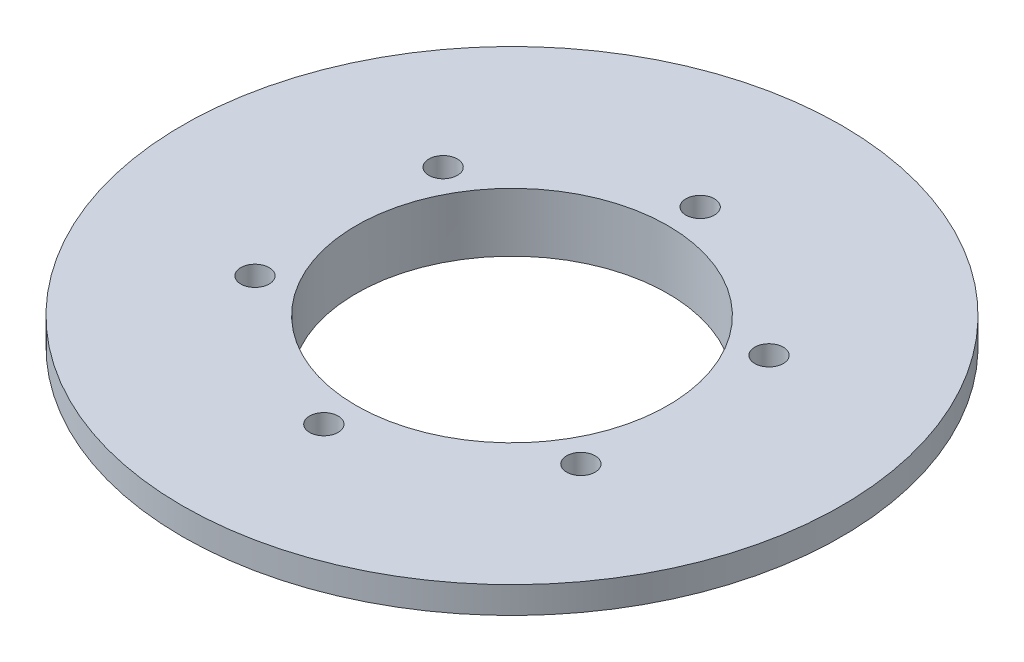
from build123d import *

# Parameters (mm, degrees)
SKETCH3_R               = 24.75
BOSS_EXTRUDE1_DEPTH     = 3.6
CUT_EXTRUDE1_DEPTH      = 53.740496774
CUT_EXTRUDE1_DEPTH_BACK = 53.740496774
SKETCH4_R               = 17.5
CUT_EXTRUDE2_DEPTH      = 53.740496774
CUT_EXTRUDE2_DEPTH_BACK = 53.740496774
SKETCH5_R               = 1.6


with BuildPart() as part:
    # Sketch2 → Revolve1 (revolve)
    with BuildSketch(Plane.XY, mode=Mode.PRIVATE) as revolve1_sk:
        with BuildLine():
            Line((-34.322848467, 0), (-37, 0))
            Line((-37, 0), (-37, 3))
            Line((-37, 3), (0, 3))
            Line((0, 3), (0, 0))
            Line((0, 0), (-29.677151533, 0))
            ThreePointArc((-29.677151533, 0), (-32, 2.225), (-34.322848467, 0))
        make_face()
    revolve(revolve1_sk.sketch.rotate(Axis((0, 0, 0), (0, 1, 0)), 270), axis=Axis((0, 0, 0), (0, 1, 0)))

    # Sketch3 → Boss-Extrude1 (add)
    with BuildSketch(Plane.XZ):
        with Locations(Location((0, 0, 0), (0, 0, 90))):
            Circle(SKETCH3_R)
    extrude(amount=BOSS_EXTRUDE1_DEPTH)

    # Sketch4 → Cut-Extrude1 (cut, two sides: drawn at the far end of the back side and taken through both)
    with BuildSketch(Plane(origin=(0, 3, 0), x_dir=(1, 0, 0), z_dir=(0, 1, 0)).offset(-CUT_EXTRUDE1_DEPTH_BACK)):
        with Locations(Location((0, 0, 0), (0, 0, 270))):
            Circle(SKETCH4_R)
    extrude(amount=CUT_EXTRUDE1_DEPTH + CUT_EXTRUDE1_DEPTH_BACK, mode=Mode.SUBTRACT)

    # Sketch5 → Cut-Extrude2 (cut, two sides: drawn at the far end of the back side and taken through both)
    with BuildSketch(Plane.XZ.offset(3.6).offset(-CUT_EXTRUDE2_DEPTH_BACK)):
        with Locations(Location((-18.294786655, 10.5625, 0), (0, 0, 270))):
            Circle(SKETCH5_R)
        with Locations(Location((-18.294786655, -10.5625, 0), (0, 0, 270))):
            Circle(SKETCH5_R)
        with Locations(Location((0, -21.125, 0), (0, 0, 270))):
            Circle(SKETCH5_R)
        with Locations(Location((0, 21.125, 0), (0, 0, 270))):
            Circle(SKETCH5_R)
        with Locations(Location((18.294786655, -10.5625, 0), (0, 0, 270))):
            Circle(SKETCH5_R)
        with Locations(Location((18.294786655, 10.5625, 0), (0, 0, 270))):
            Circle(SKETCH5_R)
    extrude(amount=CUT_EXTRUDE2_DEPTH + CUT_EXTRUDE2_DEPTH_BACK, mode=Mode.SUBTRACT)


solid = part.part
